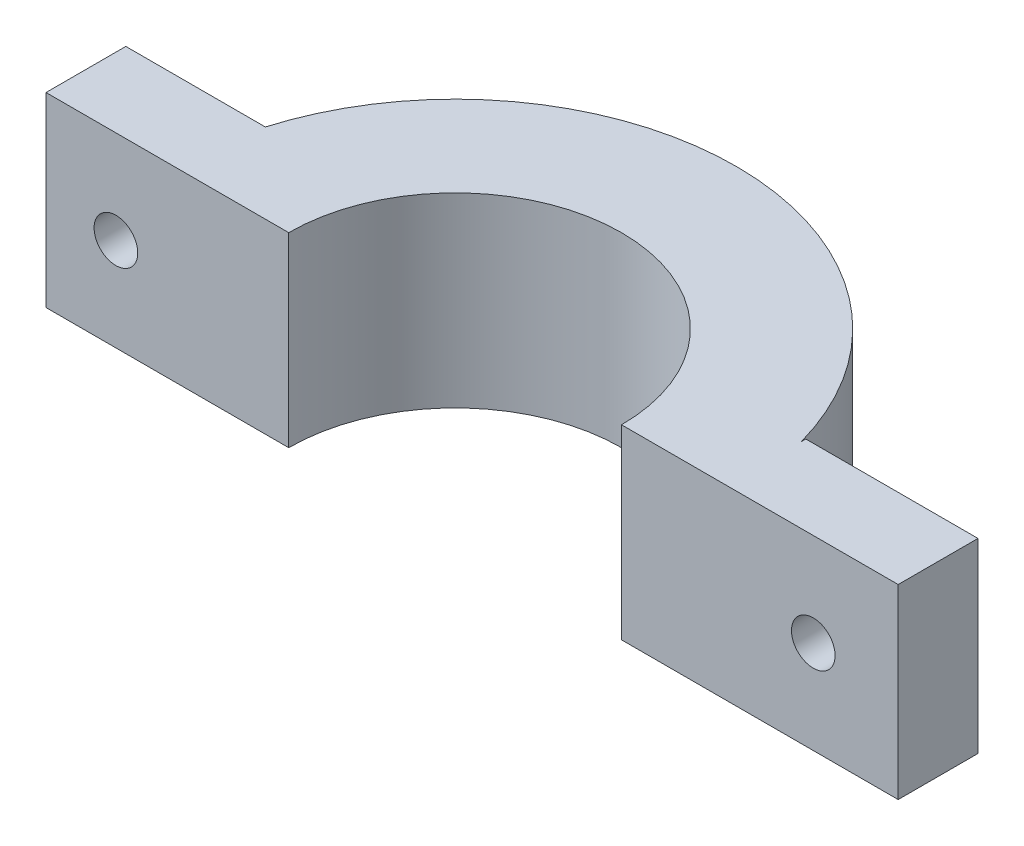
from build123d import *

# Parameters (mm, degrees)
SKETCH_1_W                = 48.51
SKETCH_1_H                = 34
SKETCH_1_W_2              = 28.51
SKETCH_1_H_2              = 14
EXTRUDE_1_DEPTH           = 12.25
SKETCH_2_R                = 1.91
CUT_EXTRUDE_1_DEPTH       = 33.05257439
SKETCH_4_W                = 13
SKETCH_4_H                = 13.91
EXTRUDE_1_2_DEPTH         = 74.82
SKETCH_5_W                = 13.91
SKETCH_5_H                = 16.23
EXTRUDE_2_DEPTH           = 15
SKETCH_7_R                = 24.5
SKETCH_7_R_2              = 14.5
EXTRUDE_2_2_DEPTH         = 16.23
SKETCH_12_R               = 1.9
CUT_EXTRUDE_4_DEPTH       = 97.312124675
EXTRUDE_3_DEPTH           = 10
EXTRUDE_3_DEPTH_BACK      = 8
SKETCH_13_W               = 13.91
SKETCH_13_H               = 16.23
SKETCH_14_R               = 1.9
CUT_EXTRUDE_5_DEPTH       = 103.744583434
SKETCH_16_W               = 90.709398763
SKETCH_16_H               = 28.955068616
CUT_EXTRUDE_7_DEPTH       = 111.229011154
SKETCH_18_W               = 13
SKETCH_18_H               = 93.080932143
CUT_EXTRUDE_10_DEPTH      = 27
CUT_EXTRUDE_11_DEPTH      = 57
CUT_EXTRUDE_11_DEPTH_BACK = 27
SKETCH_17_W               = 20.23049449
SKETCH_17_H               = 80.723570055


with BuildPart() as part:
    # 草圖1 → Extrude 1 (new body)
    with BuildSketch(Plane(origin=(0, 0, 0), x_dir=(1, 0, 0), z_dir=(0, 1, 0))):
        Rectangle(SKETCH_1_W, SKETCH_1_H)
        Rectangle(SKETCH_1_W_2, SKETCH_1_H_2, mode=Mode.SUBTRACT)
    extrude(amount=EXTRUDE_1_DEPTH)

    # 草圖2 → 除料-伸長1 (cut, through all)
    with BuildSketch(Plane(origin=(0, 12.25, 0), x_dir=(1, 0, 0), z_dir=(0, 1, 0))):
        with Locations(Location((-19.255, 0, 0), (0, 0, 270))):
            Circle(SKETCH_2_R)
        with Locations(Location((19.255, 0, 0), (0, 0, 270))):
            Circle(SKETCH_2_R)
    extrude(amount=-CUT_EXTRUDE_1_DEPTH, mode=Mode.SUBTRACT)

    # 草圖4 → Extrude 1 2 (add)
    with BuildSketch(Plane.XZ):
        with Locations((17.755, 0)):
            Rectangle(SKETCH_4_W, SKETCH_4_H)
    extrude(amount=EXTRUDE_1_2_DEPTH)

    # 草圖5 → Extrude 2 (add)
    with BuildSketch(Plane.ZY.offset(-11.255)):
        with Locations((0, -66.705)):
            Rectangle(SKETCH_5_W, SKETCH_5_H)
    extrude(amount=EXTRUDE_2_DEPTH)

    # 草圖7 → Extrude 2 2 (add)
    with BuildSketch(Plane(origin=(3.626674765, -74.82, 0), x_dir=(1, 0, 0), z_dir=(0, -1, 0))):
        with Locations((-30.978154344, 0)):
            Circle(SKETCH_7_R)
        with Locations((-30.978154344, 0)):
            Circle(SKETCH_7_R_2, mode=Mode.SUBTRACT)
    extrude(amount=-EXTRUDE_2_2_DEPTH)

    # 草圖12 → 除料-伸長4 (cut, through all)
    with BuildSketch(Plane(origin=(0, 0, -6.955), x_dir=(-1, 0, 0), z_dir=(0, 0, -1))):
        with Locations((-3.856713649, -66.705)):
            Circle(SKETCH_12_R)
    extrude(amount=-CUT_EXTRUDE_4_DEPTH, mode=Mode.SUBTRACT)

    # 草圖13 → 填料-伸長3 (add, two sides: drawn at the far end of the back side and taken through both)
    with BuildSketch(Plane(origin=(-55, 0, 0), x_dir=(0, 0, -1), z_dir=(1, 0, 0)).offset(-EXTRUDE_3_DEPTH_BACK)):
        with Locations((0, -66.705)):
            Rectangle(SKETCH_13_W, SKETCH_13_H)
    extrude(amount=EXTRUDE_3_DEPTH + EXTRUDE_3_DEPTH_BACK)

    # 草圖14 → 除料-伸長5 (cut, through all)
    with BuildSketch(Plane(origin=(0, 0, -6.955), x_dir=(-1, 0, 0), z_dir=(0, 0, -1))):
        with Locations((56.908040017, -66.705)):
            Circle(SKETCH_14_R)
    extrude(amount=-CUT_EXTRUDE_5_DEPTH, mode=Mode.SUBTRACT)

    # 草圖16 → 除料-伸長7 (cut, through all)
    with BuildSketch(Plane(origin=(0, 12.25, 0), x_dir=(1, 0, 0), z_dir=(0, 1, 0))):
        with Locations((-17.645300619, -14.477534308)):
            Rectangle(SKETCH_16_W, SKETCH_16_H)
    extrude(amount=-CUT_EXTRUDE_7_DEPTH, mode=Mode.SUBTRACT)

    # 草圖18 → 除料-伸長10 (cut)
    with BuildSketch(Plane.XY):
        with Locations((17.755, -28.279533929)):
            Rectangle(SKETCH_18_W, SKETCH_18_H)
    extrude(amount=-CUT_EXTRUDE_10_DEPTH, mode=Mode.SUBTRACT)


with BuildPart() as cut_extrude_10_piece_1:
    # of the separate pieces the step leaves, piece 1, a body of its own (cut_extrude_10_pieces)
    add(part.part.solids().sort_by_distance((11.255, -58.59, -6.955))[0])


with BuildPart() as cut_extrude_10_piece_2:
    # of the separate pieces the step leaves, piece 2, a body of its own (cut_extrude_10_pieces)
    add(part.part.solids().sort_by_distance((-17.345, 0, 0))[0])

    # 草圖17 → 除料-伸長11 (cut, two sides: drawn at the far end of the back side and taken through both)
    with BuildSketch(Plane.ZY.offset(-11.255).offset(-CUT_EXTRUDE_11_DEPTH_BACK)):
        with Locations((-10.115247245, -18.228214973)):
            Rectangle(SKETCH_17_W, SKETCH_17_H)
    extrude(amount=CUT_EXTRUDE_11_DEPTH + CUT_EXTRUDE_11_DEPTH_BACK, mode=Mode.SUBTRACT)


solid = cut_extrude_10_piece_1.part
